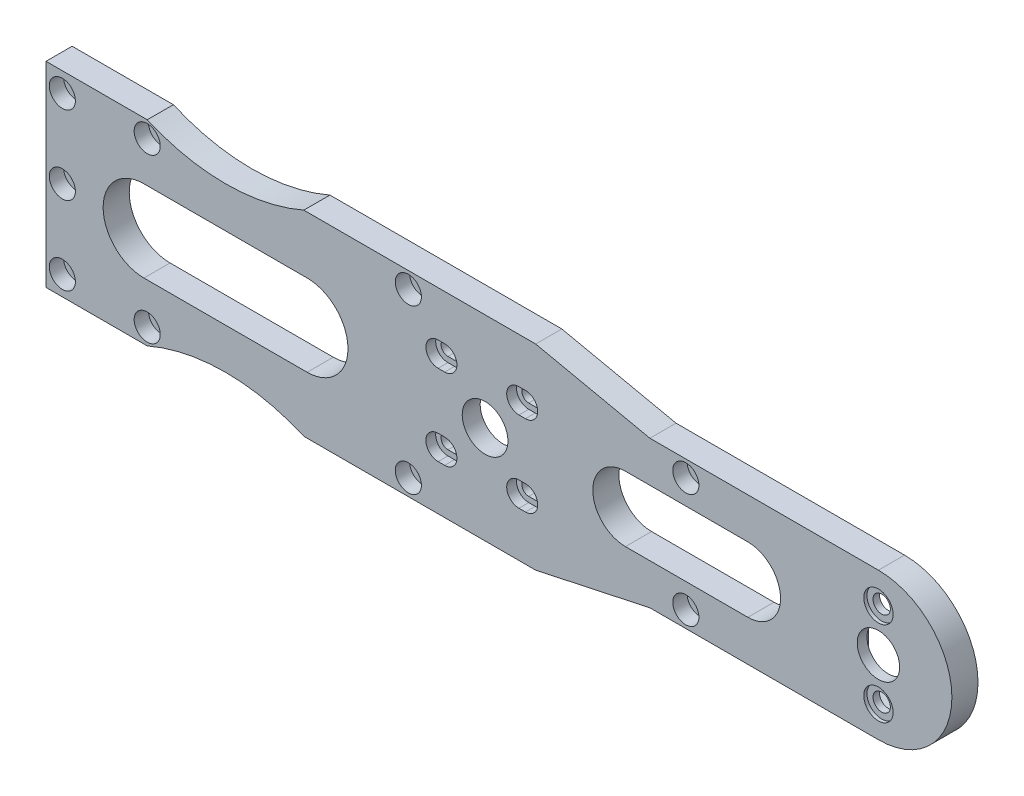
from build123d import *

# Parameters (mm, degrees)
EXTRUDE_1_DEPTH              = 8
CUT_EXTRUDE_1_DEPTH          = 10
HOLE_WIZARD_M4_1_D           = 4.5
HOLE_WIZARD_M4_1_CBORE_D     = 8
HOLE_WIZARD_M4_1_CBORE_DEPTH = 4.4
CUT_EXTRUDE_2_DEPTH          = 4
FILLET_2_R                   = 1.5
HOLE_WIZARD_13_0_13_1_D      = 13
HOLE_WIZARD_13_0_13_1_DEPTH  = 12
HOLE_WIZARD_13_0_13_1_TIP    = 3.905594024
CUT_EXTRUDE_3_DEPTH          = 5
HOLE_WIZARD_5_3_5_3_1_D      = 5.3
HOLE_WIZARD_5_3_5_3_1_DEPTH  = 12
HOLE_WIZARD_5_3_5_3_1_TIP    = 1.59228064
HOLE_WIZARD_10_0_10_1_D      = 14
HOLE_WIZARD_10_0_10_1_DEPTH  = 12
HOLE_WIZARD_10_0_10_1_TIP    = 4.206024333
SKETCH_21_R                  = 13.5
CUT_EXTRUDE_4_DEPTH          = 2.5
SKETCH_22_R                  = 4.5
CUT_EXTRUDE_5_DEPTH          = 1
CUT_EXTRUDE_6_DEPTH          = 154.839439127
CUT_EXTRUDE_7_DEPTH          = 3
FILLET_3_R                   = 1.5


with BuildPart() as part:
    # 草图1 → 凸台-拉伸1 (new body)
    with BuildSketch(Plane.XY):
        with BuildLine():
            Line((128.173730269, 22.5), (58.173730269, 22.5))
            Line((58.173730269, 22.5), (23.173730269, 30))
            Line((23.173730269, 30), (-47.847112114, 30))
            ThreePointArc((-47.847112114, 30), (-71.826269731, 25), (-95.805427348, 30))
            Line((-95.805427348, 30), (-126.826269731, 30))
            Line((-126.826269731, 30), (-126.826269731, -30))
            Line((-126.826269731, -30), (-95.805427348, -30))
            ThreePointArc((-95.805427348, -30), (-71.826269731, -25), (-47.847112114, -30))
            Line((-47.847112114, -30), (23.173730269, -30))
            Line((23.173730269, -30), (58.173730269, -22.5))
            Line((58.173730269, -22.5), (128.173730269, -22.5))
            ThreePointArc((128.173730269, -22.5), (150.673730269, 0), (128.173730269, 22.5))
        make_face()
        with BuildLine():
            Line((-96.826269731, 12.5), (-46.826269731, 12.5))
            ThreePointArc((-46.826269731, 12.5), (-34.326269731, 0), (-46.826269731, -12.5))
            Line((-46.826269731, -12.5), (-96.826269731, -12.5))
            ThreePointArc((-96.826269731, -12.5), (-109.326269731, 0), (-96.826269731, 12.5))
        make_face(mode=Mode.SUBTRACT)
    extrude(amount=EXTRUDE_1_DEPTH)

    # 草图2 → 切除-拉伸1 (cut)
    with BuildSketch(Plane.XY.offset(8)):
        with BuildLine():
            Line((50.673730269, 10), (88.173730269, 10))
            ThreePointArc((88.173730269, 10), (98.173730269, 0), (88.173730269, -10))
            Line((88.173730269, -10), (50.673730269, -10))
            ThreePointArc((50.673730269, -10), (40.673730269, 0), (50.673730269, 10))
        make_face()
    extrude(amount=-CUT_EXTRUDE_1_DEPTH, mode=Mode.SUBTRACT)

    # M4 六角凹头螺钉的柱形沉头孔1 (through all)
    with Locations(Plane.XY.offset(8)):
        with Locations((-121.826269731, 0), (-121.826269731, -24), (-121.826269731, 24), (-95.826269731, 25), (-95.826269731, -25), (-15.826269731, -25), (-15.826269731, 25), (69.173730269, 17.5), (69.173730269, -17.5)):
            CounterBoreHole(HOLE_WIZARD_M4_1_D / 2, HOLE_WIZARD_M4_1_CBORE_D / 2, HOLE_WIZARD_M4_1_CBORE_DEPTH)

    # 草图11 → 切除-拉伸2 (cut)
    # profile 1 of 3: a face of its own
    with BuildSketch(Plane(origin=(0, 0, 0), x_dir=(-1, 0, 0), z_dir=(0, 0, -1))):
        with BuildLine():
            Line((-88.173730269, 20.25), (-115.477066498, 20.25))
            Line((-115.477066498, 20.25), (-115.477066498, 9.921609041))
            ThreePointArc((-115.477066498, 9.921609041), (-113.633917887, 6.945318766), (-112.477066498, 3.64120081))
            Line((-112.477066498, 3.64120081), (-100.65337997, 3.64120081))
            ThreePointArc((-100.65337997, 3.64120081), (-95.973229915, 10.400375246), (-88.173730269, 13))
            Line((-88.173730269, 13), (-88.173730269, 20.25))
        make_face()
    # profile 2 of 3: a face of its own
    with BuildSketch(Plane(origin=(0, 0, 0), x_dir=(-1, 0, 0), z_dir=(0, 0, -1))):
        with BuildLine():
            Line((101.826269731, -27), (101.826269731, -25))
            ThreePointArc((101.826269731, -25), (96.011569063, -19.002862003), (89.837715012, -24.629578112))
            ThreePointArc((89.837715012, -24.629578112), (68.326801608, -22.097267763), (47.229521978, -27))
            Line((47.229521978, -27), (24.826269731, -27))
            Line((24.826269731, -27), (24.826269731, 27))
            Line((24.826269731, 27), (47.229521978, 27))
            ThreePointArc((47.229521978, 27), (68.326801608, 22.097267763), (89.837715012, 24.629578112))
            ThreePointArc((89.837715012, 24.629578112), (96.011569063, 19.002862003), (101.826269731, 25))
            Line((101.826269731, 25), (101.826269731, 27))
            Line((101.826269731, 27), (114.826269731, 27))
            Line((114.826269731, 27), (114.826269731, -27))
            Line((114.826269731, -27), (101.826269731, -27))
        make_face()
        with BuildLine():
            Line((96.826269731, 15.5), (46.826269731, 15.5))
            ThreePointArc((46.826269731, 15.5), (31.326269731, 0), (46.826269731, -15.5))
            Line((46.826269731, -15.5), (96.826269731, -15.5))
            ThreePointArc((96.826269731, -15.5), (112.326269731, 0), (96.826269731, 15.5))
        make_face(mode=Mode.SUBTRACT)
    # profile 3 of 3: a face of its own
    with BuildSketch(Plane(origin=(0, 0, 0), x_dir=(-1, 0, 0), z_dir=(0, 0, -1))):
        with BuildLine():
            Line((-115.244901013, -19.5), (-88.173730269, -19.5))
            Line((-88.173730269, -19.5), (-88.173730269, -13))
            ThreePointArc((-88.173730269, -13), (-95.668248617, -10.622249984), (-100.421214485, -4.35879919))
            Line((-100.421214485, -4.35879919), (-112.244901013, -4.35879919))
            ThreePointArc((-112.244901013, -4.35879919), (-113.444814316, -7.468986993), (-115.244901013, -10.274828753))
            Line((-115.244901013, -10.274828753), (-115.244901013, -19.5))
        make_face()
    extrude(amount=-CUT_EXTRUDE_2_DEPTH, mode=Mode.SUBTRACT)

    # 圆角2
    fillet_2_edges = [part.edges().sort_by_distance(p)[0] for p in [
        (115.477066498, 9.921609041, 2),
        (115.477066498, 20.25, 2),
        (88.173730269, 20.25, 2),
        (88.173730269, 13, 2),
        (100.65337997, 3.64120081, 2),
        (112.477066498, 3.64120081, 2),
        (-24.826269731, -27, 2),
        (-24.826269731, 27, 2),
        (-89.837715012, 24.629578112, 2),
        (-101.826269731, 27, 2),
        (-114.826269731, 27, 2),
        (-114.826269731, -27, 2),
        (-101.826269731, -27, 2),
        (-89.837715012, -24.629578112, 2),
        (100.421214485, -4.35879919, 2),
        (88.173730269, -13, 2),
        (88.173730269, -19.5, 2),
        (115.244901013, -19.5, 2),
        (115.244901013, -10.274828753, 2),
        (112.244901013, -4.35879919, 2),
    ]]
    fillet(fillet_2_edges, radius=FILLET_2_R)

    # Ø13.0 (13) 直径孔1
    with Locations(Plane.XY.offset(8)):
        with Locations((128.173730269, 0)):
            Hole(HOLE_WIZARD_13_0_13_1_D / 2, depth=HOLE_WIZARD_13_0_13_1_DEPTH)
            with Locations((0, 0, -(HOLE_WIZARD_13_0_13_1_DEPTH + HOLE_WIZARD_13_0_13_1_TIP / 2))):  # 118° drill point
                Cone(0, HOLE_WIZARD_13_0_13_1_D / 2, HOLE_WIZARD_13_0_13_1_TIP, mode=Mode.SUBTRACT)

    # 草图14 → 切除-拉伸3 (cut)
    with BuildSketch(Plane(origin=(0, 0, 0), x_dir=(-1, 0, 0), z_dir=(0, 0, -1))):
        with BuildLine():
            Line((-139.173730269, 14.247806849), (-139.173730269, -14.247806849))
            ThreePointArc((-139.173730269, -14.247806849), (-128.173730269, -18), (-117.173730269, -14.247806849))
            Line((-117.173730269, -14.247806849), (-117.173730269, 14.247806849))
            ThreePointArc((-117.173730269, 14.247806849), (-128.173730269, 18), (-139.173730269, 14.247806849))
        make_face()
    extrude(amount=-CUT_EXTRUDE_3_DEPTH, mode=Mode.SUBTRACT)

    # Ø5.3 (5.3) 直径孔1
    with Locations(Plane.XY.offset(8)):
        with Locations((128.173730269, 13), (128.173730269, -13)):
            Hole(HOLE_WIZARD_5_3_5_3_1_D / 2, depth=HOLE_WIZARD_5_3_5_3_1_DEPTH)
            with Locations((0, 0, -(HOLE_WIZARD_5_3_5_3_1_DEPTH + HOLE_WIZARD_5_3_5_3_1_TIP / 2))):  # 118° drill point
                Cone(0, HOLE_WIZARD_5_3_5_3_1_D / 2, HOLE_WIZARD_5_3_5_3_1_TIP, mode=Mode.SUBTRACT)

    # Ø10.0 (10) 直径孔1
    with Locations(Plane(origin=(0, 0, 0), x_dir=(-1, 0, 0), z_dir=(0, 0, -1))):
        with Locations((-7.673730269, 0)):
            Hole(HOLE_WIZARD_10_0_10_1_D / 2, depth=HOLE_WIZARD_10_0_10_1_DEPTH)
            with Locations((0, 0, -(HOLE_WIZARD_10_0_10_1_DEPTH + HOLE_WIZARD_10_0_10_1_TIP / 2))):  # 118° drill point
                Cone(0, HOLE_WIZARD_10_0_10_1_D / 2, HOLE_WIZARD_10_0_10_1_TIP, mode=Mode.SUBTRACT)

    # 草图21 → 切除-拉伸4 (cut)
    with BuildSketch(Plane(origin=(0, 0, 0), x_dir=(-1, 0, 0), z_dir=(0, 0, -1))):
        with Locations((-7.673730269, 0)):
            Circle(SKETCH_21_R)
    extrude(amount=-CUT_EXTRUDE_4_DEPTH, mode=Mode.SUBTRACT)

    # 草图22 → 切除-拉伸5 (cut)
    with BuildSketch(Plane.XY.offset(8)):
        with Locations((128.173730269, -13)):
            Circle(SKETCH_22_R)
        with Locations((128.173730269, 13)):
            Circle(SKETCH_22_R)
    extrude(amount=-CUT_EXTRUDE_5_DEPTH, mode=Mode.SUBTRACT)

    # 草图23 → 切除-拉伸6 (cut, through all)
    with BuildSketch(Plane.XY.offset(8)):
        with BuildLine():
            Line((20.04809894, 10.274368671), (18.04809894, 10.274368671))
            ThreePointArc((18.04809894, 10.274368671), (15.94809894, 12.374368671), (18.04809894, 14.474368671))
            Line((18.04809894, 14.474368671), (20.04809894, 14.474368671))
            ThreePointArc((20.04809894, 14.474368671), (22.14809894, 12.374368671), (20.04809894, 10.274368671))
        make_face()
        with BuildLine():
            Line((-6.700638402, 14.474368671), (-4.700638402, 14.474368671))
            ThreePointArc((-4.700638402, 14.474368671), (-2.600638402, 12.374368671), (-4.700638402, 10.274368671))
            Line((-4.700638402, 10.274368671), (-6.700638402, 10.274368671))
            ThreePointArc((-6.700638402, 10.274368671), (-8.800638402, 12.374368671), (-6.700638402, 14.474368671))
        make_face()
        with BuildLine():
            Line((20.04809894, -14.474368671), (18.04809894, -14.474368671))
            ThreePointArc((18.04809894, -14.474368671), (15.94809894, -12.374368671), (18.04809894, -10.274368671))
            Line((18.04809894, -10.274368671), (20.04809894, -10.274368671))
            ThreePointArc((20.04809894, -10.274368671), (22.14809894, -12.374368671), (20.04809894, -14.474368671))
        make_face()
        with BuildLine():
            Line((-4.700638402, -14.474368671), (-6.700638402, -14.474368671))
            ThreePointArc((-6.700638402, -14.474368671), (-8.800638402, -12.374368671), (-6.700638402, -10.274368671))
            Line((-6.700638402, -10.274368671), (-4.700638402, -10.274368671))
            ThreePointArc((-4.700638402, -10.274368671), (-2.600638402, -12.374368671), (-4.700638402, -14.474368671))
        make_face()
    extrude(amount=-CUT_EXTRUDE_6_DEPTH, mode=Mode.SUBTRACT)

    # 草图24 → 切除-拉伸7 (cut)
    with BuildSketch(Plane.XY.offset(8)):
        with BuildLine():
            Line((-4.700638402, 8.624368671), (-6.700638402, 8.624368671))
            ThreePointArc((-6.700638402, 8.624368671), (-10.450638402, 12.374368671), (-6.700638402, 16.124368671))
            Line((-6.700638402, 16.124368671), (-4.700638402, 16.124368671))
            ThreePointArc((-4.700638402, 16.124368671), (-0.950638402, 12.374368671), (-4.700638402, 8.624368671))
        make_face()
        with BuildLine():
            Line((18.04809894, 16.124368671), (20.04809894, 16.124368671))
            ThreePointArc((20.04809894, 16.124368671), (23.79809894, 12.374368671), (20.04809894, 8.624368671))
            Line((20.04809894, 8.624368671), (18.04809894, 8.624368671))
            ThreePointArc((18.04809894, 8.624368671), (14.29809894, 12.374368671), (18.04809894, 16.124368671))
        make_face()
        with BuildLine():
            Line((18.04809894, -8.624368671), (20.04809894, -8.624368671))
            ThreePointArc((20.04809894, -8.624368671), (23.79809894, -12.374368671), (20.04809894, -16.124368671))
            Line((20.04809894, -16.124368671), (18.04809894, -16.124368671))
            ThreePointArc((18.04809894, -16.124368671), (14.29809894, -12.374368671), (18.04809894, -8.624368671))
        make_face()
        with BuildLine():
            Line((-4.700638402, -16.124368671), (-6.700638402, -16.124368671))
            ThreePointArc((-6.700638402, -16.124368671), (-10.450638402, -12.374368671), (-6.700638402, -8.624368671))
            Line((-6.700638402, -8.624368671), (-4.700638402, -8.624368671))
            ThreePointArc((-4.700638402, -8.624368671), (-0.950638402, -12.374368671), (-4.700638402, -16.124368671))
        make_face()
    extrude(amount=-CUT_EXTRUDE_7_DEPTH, mode=Mode.SUBTRACT)

    # 圆角3
    fillet_3_edges = [part.edges().sort_by_distance(p)[0] for p in [
        (-47.229521978, 27, 2),
        (-47.229521978, -27, 2),
        (117.173730269, -14.247806849, 2.5),
        (139.173730269, -14.247806849, 2.5),
        (139.173730269, 14.247806849, 2.5),
        (117.173730269, 14.247806849, 2.5),
    ]]
    fillet(fillet_3_edges, radius=FILLET_3_R)


solid = part.part
